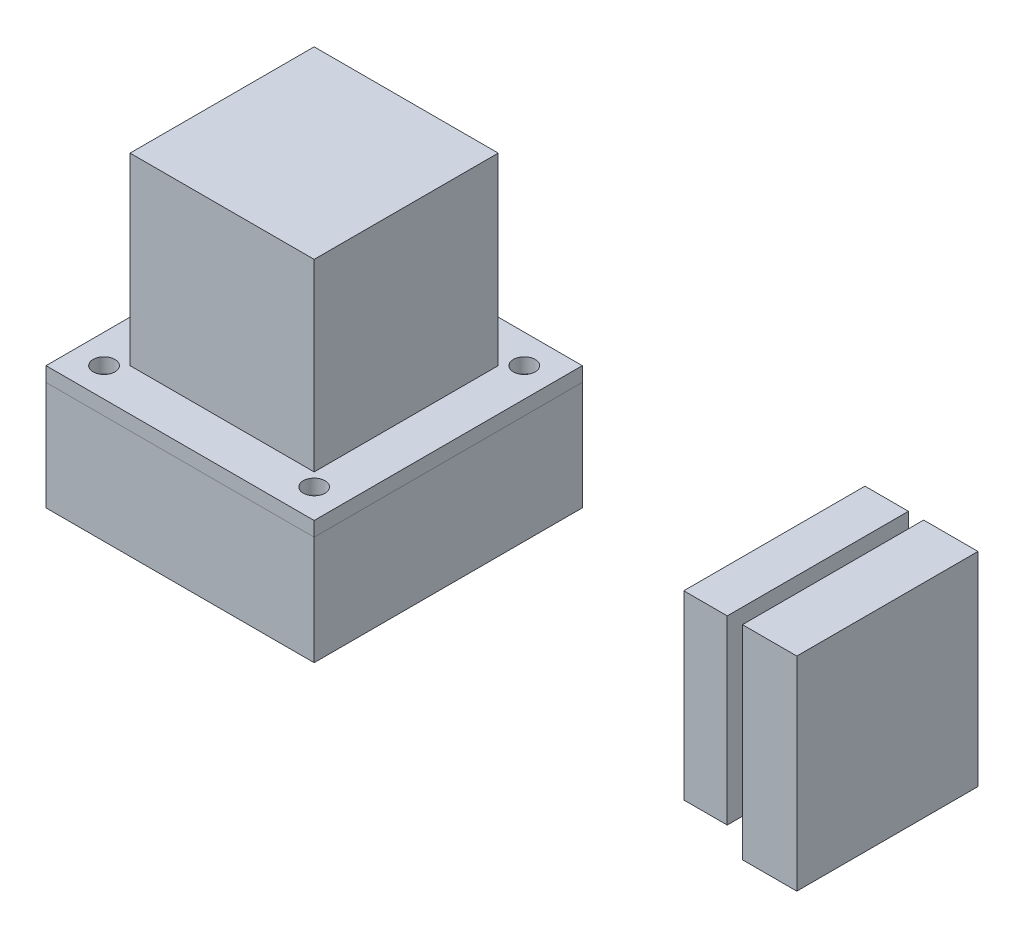
from build123d import *

# Parameters (mm, degrees)
SKETCH1_W           = 25
SKETCH1_H           = 25
BOSS_EXTRUDE1_DEPTH = 6
SKETCH3_W           = 25
SKETCH3_H           = 28.1
BOSS_EXTRUDE2_DEPTH = 7.5
SKETCH11_W          = 37
SKETCH11_H          = 37
SKETCH11_R          = 1.5
BOSS_EXTRUDE4_DEPTH = 15
SKETCH12_W          = 37
SKETCH12_H          = 37
SKETCH12_R          = 1.5
BOSS_EXTRUDE5_DEPTH = 2
SKETCH13_W          = 25.4
SKETCH13_H          = 25.4
BOSS_EXTRUDE6_DEPTH = 25.4


with BuildPart() as part:
    # Sketch1 → Boss-Extrude1 (new body)
    with BuildSketch(Plane(origin=(0, 0, 0), x_dir=(0, 0, -1), z_dir=(1, 0, 0))):
        Rectangle(SKETCH1_W, SKETCH1_H)
    extrude(amount=BOSS_EXTRUDE1_DEPTH)


with BuildPart() as body_2:
    # Sketch3 → Boss-Extrude2 (new body)
    with BuildSketch(Plane.ZY.offset(-15.6)):
        with Locations((0, -1.55)):
            Rectangle(SKETCH3_W, SKETCH3_H)
    extrude(amount=BOSS_EXTRUDE2_DEPTH)


with BuildPart() as body_3:
    # Sketch11 → Boss-Extrude4 (new body)
    with BuildSketch(Plane.XZ.offset(15.6)):
        with Locations((-63.5, 0)):
            Rectangle(SKETCH11_W, SKETCH11_H)
        with Locations(Location((-49.004310986, 14.495689014, 0), (0, 0, 270))):
            Circle(SKETCH11_R, mode=Mode.SUBTRACT)
        with Locations(Location((-49.004310986, -14.495689014, 0), (0, 0, 270))):
            Circle(SKETCH11_R, mode=Mode.SUBTRACT)
        with Locations(Location((-77.995689014, -14.495689014, 0), (0, 0, 270))):
            Circle(SKETCH11_R, mode=Mode.SUBTRACT)
        with Locations(Location((-77.995689014, 14.495689014, 0), (0, 0, 270))):
            Circle(SKETCH11_R, mode=Mode.SUBTRACT)
    extrude(amount=-BOSS_EXTRUDE4_DEPTH)


with BuildPart() as body_4:
    # Sketch12 → Boss-Extrude5 (new body)
    with BuildSketch(Plane(origin=(0, -0.6, 0), x_dir=(1, 0, 0), z_dir=(0, 1, 0))):
        with Locations((-63.5, 0)):
            Rectangle(SKETCH12_W, SKETCH12_H)
        with Locations(Location((-77.995689014, -14.495689014, 0), (0, 0, 270))):
            Circle(SKETCH12_R, mode=Mode.SUBTRACT)
        with Locations(Location((-77.995689014, 14.495689014, 0), (0, 0, 270))):
            Circle(SKETCH12_R, mode=Mode.SUBTRACT)
        with Locations(Location((-49.004310986, 14.495689014, 0), (0, 0, 270))):
            Circle(SKETCH12_R, mode=Mode.SUBTRACT)
        with Locations(Location((-49.004310986, -14.495689014, 0), (0, 0, 270))):
            Circle(SKETCH12_R, mode=Mode.SUBTRACT)
    extrude(amount=BOSS_EXTRUDE5_DEPTH)


with BuildPart() as body_5:
    # Sketch13 → Boss-Extrude6 (new body)
    with BuildSketch(Plane(origin=(0, 1.4, 0), x_dir=(1, 0, 0), z_dir=(0, 1, 0))):
        with Locations((-63.5, 0)):
            Rectangle(SKETCH13_W, SKETCH13_H)
    extrude(amount=BOSS_EXTRUDE6_DEPTH)


solid = Compound([part.part, body_2.part, body_3.part, body_4.part, body_5.part])
